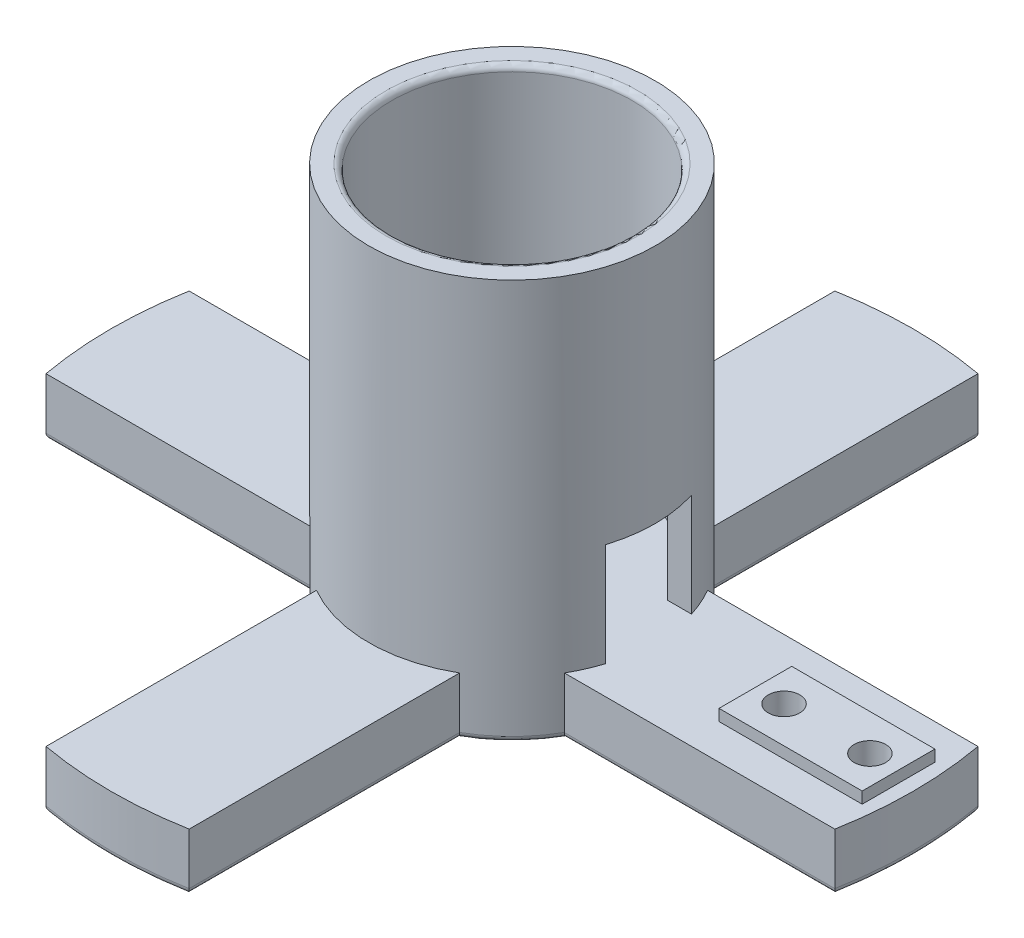
from build123d import *

# Parameters (mm, degrees)
BOSS_EXTRUDE1_DEPTH = 10
SKETCH2_R           = 25
SKETCH2_R_2         = 21
BOSS_EXTRUDE2_DEPTH = 60
SKETCH3_W           = 15
SKETCH3_H           = 18
CUT_EXTRUDE1_DEPTH  = 10
SKETCH4_W           = 25
SKETCH4_H           = 12.7
BOSS_EXTRUDE3_DEPTH = 2
SKETCH5_R           = 2.75
CUT_EXTRUDE2_DEPTH  = 115.734476074
SKETCH6_R           = 5
CUT_EXTRUDE3_DEPTH  = 6
FILLET1_R           = 1


with BuildPart() as part:
    # Sketch1 → Boss-Extrude1 (new body)
    with BuildSketch(Plane(origin=(0, 0, 0), x_dir=(1, 0, 0), z_dir=(0, 1, 0))):
        with BuildLine():
            Line((-68.87488657, 12.5), (-21.650635095, 12.5))
            ThreePointArc((-21.650635095, 12.5), (-17.67766953, 17.67766953), (-12.5, 21.650635095))
            Line((-12.5, 21.650635095), (-12.5, 68.87488657))
            ThreePointArc((-12.5, 68.87488657), (0, 70), (12.5, 68.87488657))
            Line((12.5, 68.87488657), (12.5, 21.650635095))
            ThreePointArc((12.5, 21.650635095), (17.67766953, 17.67766953), (21.650635095, 12.5))
            Line((21.650635095, 12.5), (68.87488657, 12.5))
            ThreePointArc((68.87488657, 12.5), (70, 0), (68.87488657, -12.5))
            Line((68.87488657, -12.5), (21.650635095, -12.5))
            ThreePointArc((21.650635095, -12.5), (17.67766953, -17.67766953), (12.5, -21.650635095))
            Line((12.5, -21.650635095), (12.5, -68.87488657))
            ThreePointArc((12.5, -68.87488657), (0, -70), (-12.5, -68.87488657))
            Line((-12.5, -68.87488657), (-12.5, -21.650635095))
            ThreePointArc((-12.5, -21.650635095), (-17.67766953, -17.67766953), (-21.650635095, -12.5))
            Line((-21.650635095, -12.5), (-68.87488657, -12.5))
            ThreePointArc((-68.87488657, -12.5), (-70, 0), (-68.87488657, 12.5))
        make_face()
    extrude(amount=BOSS_EXTRUDE1_DEPTH)

    # Sketch2 → Boss-Extrude2 (add)
    with BuildSketch(Plane(origin=(0, 10, 0), x_dir=(1, 0, 0), z_dir=(0, 1, 0))):
        with Locations(Location((0, 0, 0), (0, 0, 120))):
            Circle(SKETCH2_R)
        with Locations(Location((0, 0, 0), (0, 0, 270))):
            Circle(SKETCH2_R_2, mode=Mode.SUBTRACT)
    extrude(amount=BOSS_EXTRUDE2_DEPTH)

    # Sketch3 → Cut-Extrude1 (cut)
    with BuildSketch(Plane(origin=(25, 0, 0), x_dir=(0, 0, -1), z_dir=(1, 0, 0))):
        with Locations((0, 19)):
            Rectangle(SKETCH3_W, SKETCH3_H)
    extrude(amount=-CUT_EXTRUDE1_DEPTH, mode=Mode.SUBTRACT)

    # Sketch4 → Boss-Extrude3 (add)
    with BuildSketch(Plane(origin=(0, 10, 0), x_dir=(1, 0, 0), z_dir=(0, 1, 0))):
        with Locations((55, 0)):
            Rectangle(SKETCH4_W, SKETCH4_H)
    extrude(amount=BOSS_EXTRUDE3_DEPTH)

    # Sketch5 → Cut-Extrude2 (cut, through all)
    with BuildSketch(Plane(origin=(0, 12, 0), x_dir=(1, 0, 0), z_dir=(0, 1, 0))):
        with Locations(Location((47.5, 0, 0), (0, 0, 270))):
            Circle(SKETCH5_R)
        with Locations(Location((62.5, 0, 0), (0, 0, 90))):
            Circle(SKETCH5_R)
    extrude(amount=-CUT_EXTRUDE2_DEPTH, mode=Mode.SUBTRACT)

    # Sketch6 → Cut-Extrude3 (cut)
    with BuildSketch(Plane.XZ):
        with Locations(Location((47.5, 0, 0), (0, 0, 270))):
            Circle(SKETCH6_R)
        with Locations(Location((62.5, 0, 0), (0, 0, 270))):
            Circle(SKETCH6_R)
    extrude(amount=-CUT_EXTRUDE3_DEPTH, mode=Mode.SUBTRACT)

    # Fillet1
    fillet1_edges = [part.edges().sort_by_distance(p)[0] for p in [
        (47.5, 0, 5),
        (62.5, 0, 5),
        (-45.262760832, 0, -12.5),
        (-17.67766953, 0, -17.67766953),
        (-12.5, 0, -45.262760832),
        (0, 0, -70),
        (12.5, 0, -45.262760832),
        (17.67766953, 0, -17.67766953),
        (45.262760832, 0, -12.5),
        (70, 0, 0),
        (45.262760832, 0, 12.5),
        (17.67766953, 0, 17.67766953),
        (12.5, 0, 45.262760832),
        (0, 0, 70),
        (-12.5, 0, 45.262760832),
        (-17.67766953, 0, 17.67766953),
        (-45.262760832, 0, 12.5),
        (-70, 0, 0),
        (0, 70, -21),
    ]]
    fillet(fillet1_edges, radius=FILLET1_R)


solid = part.part
